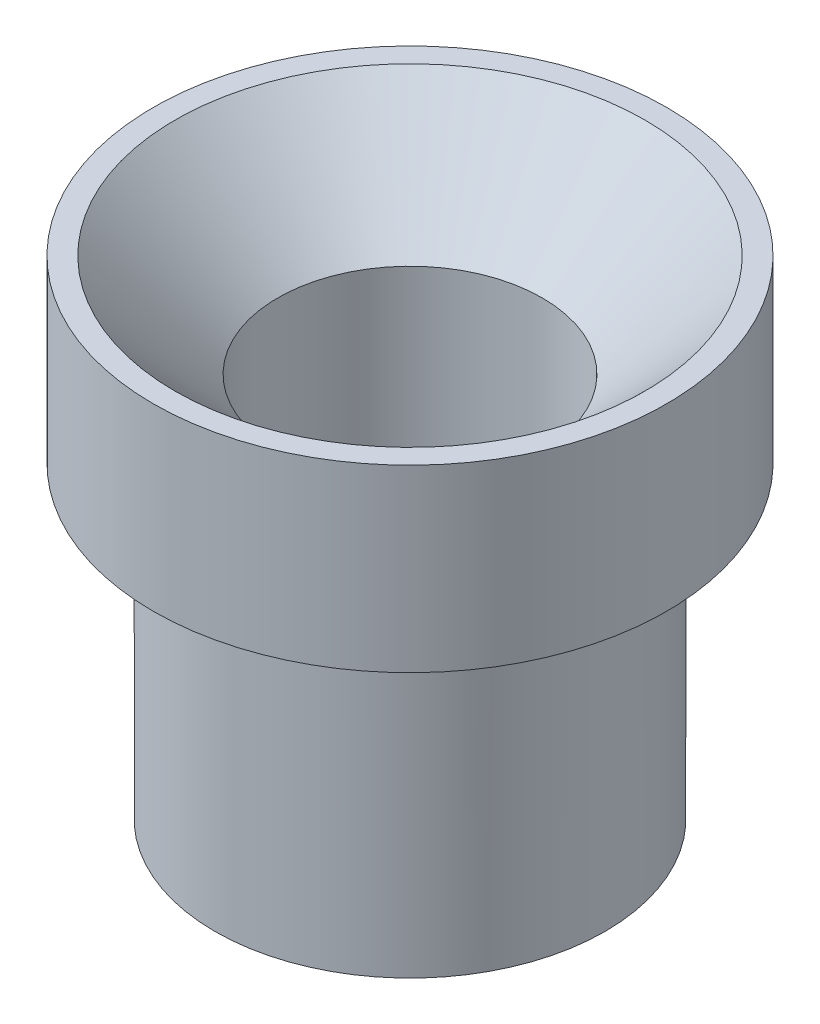
from build123d import *

# Parameters (mm, degrees)
SKETCH1_R           = 5
BOSS_EXTRUDE1_DEPTH = 3.5
SKETCH2_R           = 2.575
CUT_EXTRUDE1_DEPTH  = 3.5
CHAMFER1_SIZE       = 2
SKETCH3_R           = 3.8
BOSS_EXTRUDE2_DEPTH = 6
CUT_EXTRUDE2_START  = -6
SKETCH4_R           = 2.575
CUT_EXTRUDE2_DEPTH  = 6


with BuildPart() as part:
    # Sketch1 → Boss-Extrude1 (new body)
    with BuildSketch(Plane(origin=(0, 0, 0), x_dir=(1, 0, 0), z_dir=(0, 1, 0))):
        with Locations(Location((0, 0, 0), (0, 0, 270))):
            Circle(SKETCH1_R)
    extrude(amount=BOSS_EXTRUDE1_DEPTH)

    # Sketch2 → Cut-Extrude1 (cut)
    with BuildSketch(Plane(origin=(0, 3.5, 0), x_dir=(1, 0, 0), z_dir=(0, 1, 0))):
        with Locations(Location((0, 0, 0), (0, 0, 270))):
            Circle(SKETCH2_R)
    extrude(amount=-CUT_EXTRUDE1_DEPTH, mode=Mode.SUBTRACT)

    # Chamfer1
    chamfer1_edges = [part.edges().sort_by_distance(p)[0] for p in [
        (0, 3.5, -2.575),
    ]]
    chamfer(chamfer1_edges, length=CHAMFER1_SIZE)

    # Sketch3 → Boss-Extrude2 (add)
    with BuildSketch(Plane.XZ):
        with Locations(Location((0, 0, 0), (0, 0, 90))):
            Circle(SKETCH3_R)
    extrude(amount=BOSS_EXTRUDE2_DEPTH)

    # Sketch4 → Cut-Extrude2 (cut)
    with BuildSketch(Plane.XZ.offset(6).offset(CUT_EXTRUDE2_START)):
        with Locations(Location((0, 0, 0), (0, 0, 90))):
            Circle(SKETCH4_R)
    extrude(amount=CUT_EXTRUDE2_DEPTH, mode=Mode.SUBTRACT)


solid = part.part
